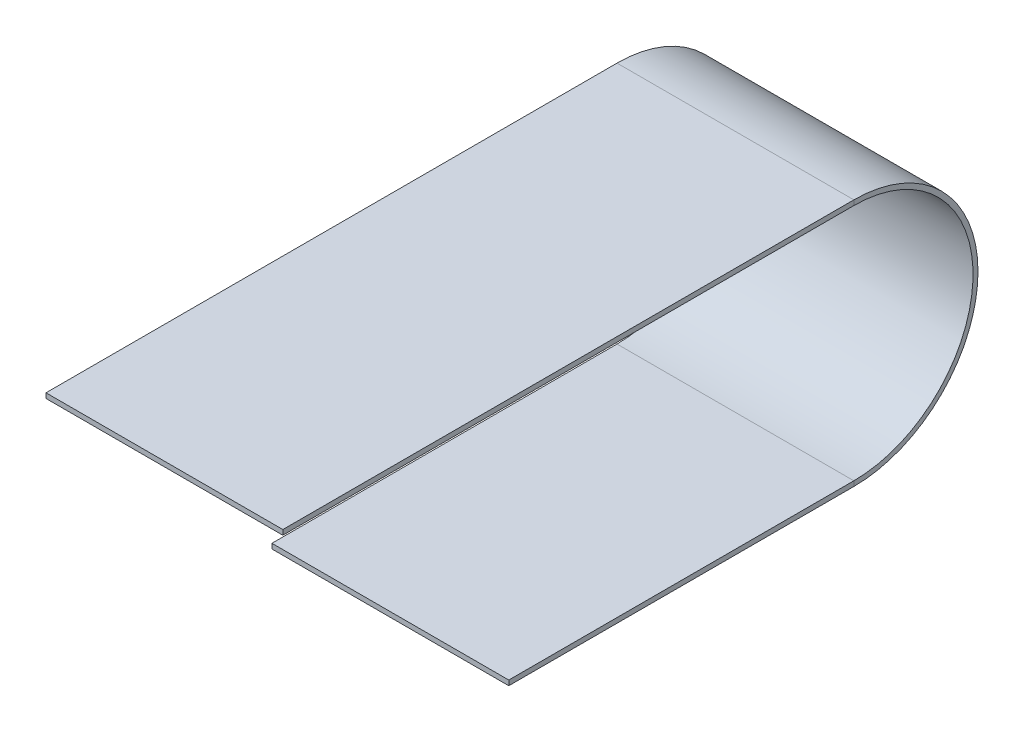
from build123d import *

# Parameters (mm, degrees)
SKETCH_1_W = 9.54
SKETCH_1_H = 0.2


with BuildPart() as part:
    # 스윕1: sweep along a path in 스케치3
    with BuildLine(Plane(origin=(20, 0, 0), x_dir=(0, 0, -1), z_dir=(1, 0, 0))) as sweep_1_path:
        Line((8.8, 0), (31.8, 0))
        ThreePointArc((31.8, 0), (36.8, -5), (31.8, -10))
        Line((31.8, -10), (17.9, -10))
    # 스케치1 → 스윕1 (sweep)
    with BuildSketch(Plane(origin=(0, 0, -8.8), x_dir=(-1, 0, 0), z_dir=(0, 0, -1))):
        with Locations((-20, -0.1)):
            Rectangle(SKETCH_1_W, SKETCH_1_H)
    sweep(path=sweep_1_path.line)


solid = part.part
